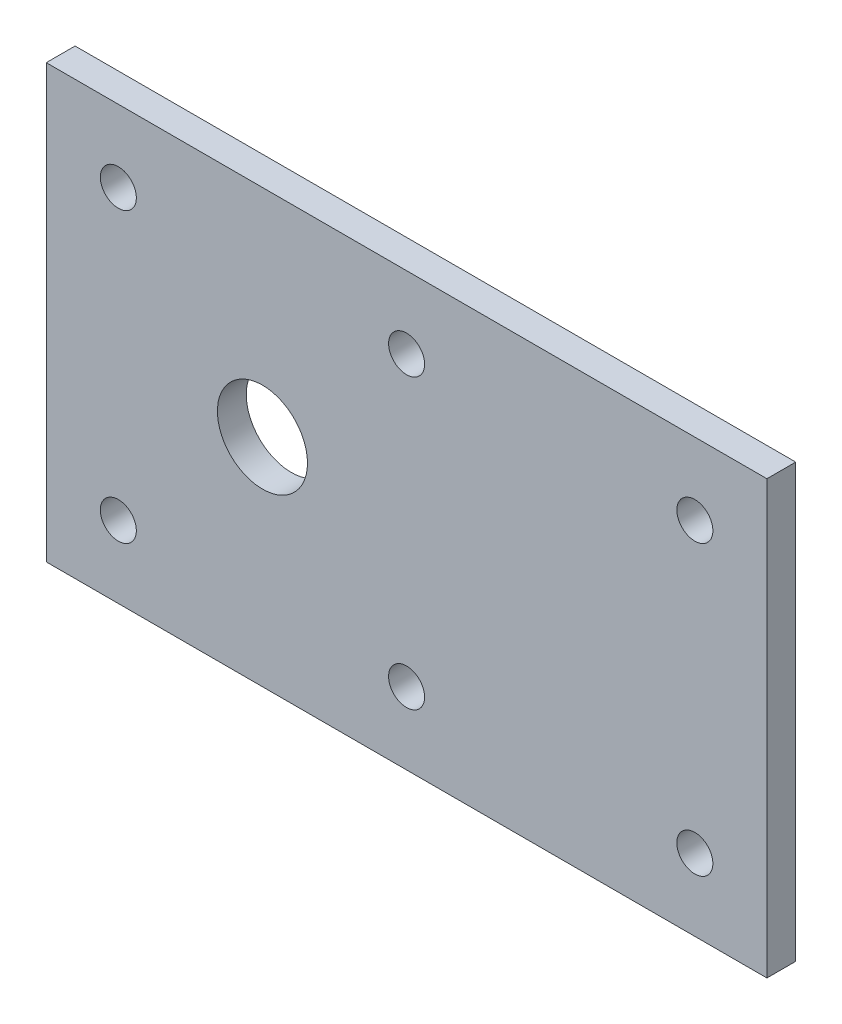
from build123d import *

# Parameters (mm, degrees)
SKETCH1_W            = 200
SKETCH1_H            = 120
BOSS_EXTRUDE1_DEPTH  = 8
SKETCH2_R            = 5
CUT_EXTRUDE1_DEPTH   = 153.52540772
LPATTERN1_COUNT      = 3
LPATTERN1_PITCH      = 80
LPATTERN1_COUNT_DIR2 = 2
LPATTERN1_PITCH_DIR2 = 80
SKETCH3_R            = 12.5
CUT_EXTRUDE2_DEPTH   = 153.52540772


with BuildPart() as part:
    # Sketch1 → Boss-Extrude1 (new body)
    with BuildSketch(Plane.XY):
        with Locations((40, 0)):
            Rectangle(SKETCH1_W, SKETCH1_H)
    extrude(amount=BOSS_EXTRUDE1_DEPTH)

    # Sketch2 → Cut-Extrude1 (cut, through all)
    with BuildSketch(Plane.XY.offset(8)):
        with Locations((-40, 40)):
            Circle(SKETCH2_R)
    cut_extrude1 = extrude(amount=-CUT_EXTRUDE1_DEPTH, mode=Mode.SUBTRACT)

    # LPattern1: Cut-Extrude1 3 × 2
    with Locations(*[(i * LPATTERN1_PITCH, -j * LPATTERN1_PITCH_DIR2, 0) for i in range(LPATTERN1_COUNT) for j in range(LPATTERN1_COUNT_DIR2) if (i, j) != (0, 0)]):
        add(cut_extrude1, mode=Mode.SUBTRACT)

    # Sketch3 → Cut-Extrude2 (cut, through all)
    with BuildSketch(Plane.XY.offset(8)):
        Circle(SKETCH3_R)
    extrude(amount=-CUT_EXTRUDE2_DEPTH, mode=Mode.SUBTRACT)


solid = part.part
